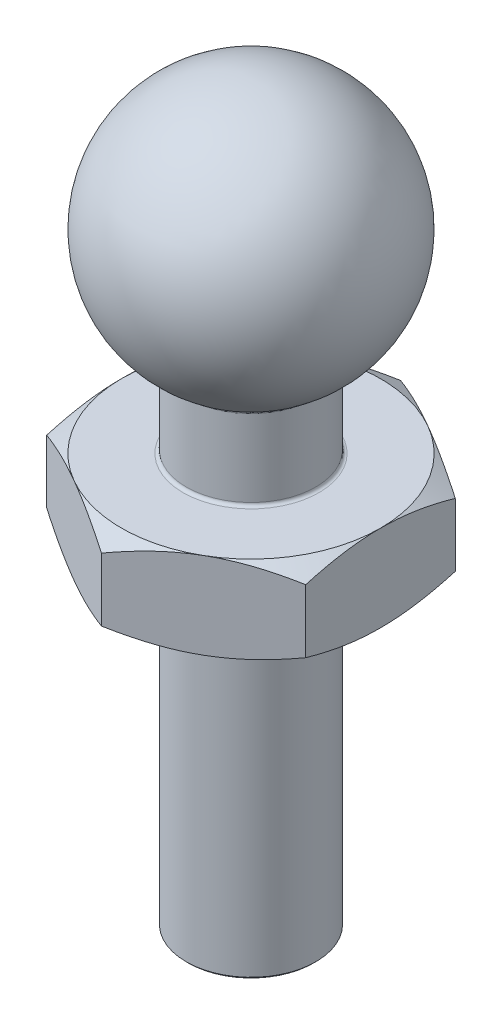
from build123d import *

# Parameters (mm, degrees)
CHAMFER1_SIZE       = 0.05
BOSS_EXTRUDE1_START = 2
SKETCH3_R           = 1.5
BOSS_EXTRUDE1_DEPTH = 2
SKETCH4_OUTSIDE_W   = 18.79
SKETCH4_OUTSIDE_H   = 19.718
SKETCH4_OUTSIDE_R   = 3
CUT_EXTRUDE1_DEPTH  = 2
CUT_EXTRUDE1_DRAFT  = -60
SKETCH5_OUTSIDE_W   = 18.79
SKETCH5_OUTSIDE_H   = 19.718
SKETCH5_OUTSIDE_R   = 3
CUT_EXTRUDE2_DEPTH  = 2
CUT_EXTRUDE2_DRAFT  = -60
FILLET1_R           = 0.075


with BuildPart() as part:
    # Sketch1 → Revolve1 (revolve)
    with BuildSketch(Plane.XY):
        with BuildLine():
            Line((0, 0), (1.5, 0))
            Line((1.5, 0), (1.5, 11.401923789))
            ThreePointArc((1.5, 11.401923789), (2.897777479, 14.776457135), (0, 17))
            Line((0, 17), (0, 11))
            Line((0, 11), (0, 0))
        make_face()
    revolve(axis=Axis((0, 11, 0), (0, -1, 0)))

    # Chamfer1
    chamfer1_edges = [part.edges().sort_by_distance(p)[0] for p in [
        (-1.5, 0, 0),
    ]]
    chamfer(chamfer1_edges, length=CHAMFER1_SIZE)

    # Sketch3 → Boss-Extrude1 (add)
    with BuildSketch(Plane(origin=(0, 7.5, 0), x_dir=(1, 0, 0), z_dir=(0, 1, 0)).offset(BOSS_EXTRUDE1_START)):
        Polygon((0, -3.464101615), (3, -1.732050808), (3, 1.732050808), (0, 3.464101615), (-3, 1.732050808), (-3, -1.732050808), align=None)
        with Locations(Location((0, 0, 0), (0, 0, 270))):
            Circle(SKETCH3_R, mode=Mode.SUBTRACT)
    extrude(amount=-BOSS_EXTRUDE1_DEPTH)


with BuildPart() as cut_extrude1_tool:
    # Sketch4 outside → Cut-Extrude1 (with draft: the straight prism first)
    with BuildSketch(Plane.XZ.offset(-7.5)):
        Rectangle(SKETCH4_OUTSIDE_W, SKETCH4_OUTSIDE_H)
        Circle(SKETCH4_OUTSIDE_R, mode=Mode.SUBTRACT)
    extrude(amount=-CUT_EXTRUDE1_DEPTH)
    # Cut-Extrude1: the draft: its side faces are tilted about the plane it starts from
    cut_extrude1_sides = [cut_extrude1_tool.faces().sort_by_distance(p)[0] for p in [
        (0, 8.5, -9.859),
        (9.395, 8.5, 0),
        (0, 8.5, 9.859),
        (-9.395, 8.5, 0),
        (-3, 8.5, 0),
    ]]
    draft(cut_extrude1_sides, Plane.XZ.offset(-7.5), CUT_EXTRUDE1_DRAFT)


with BuildPart() as part_1:
    add(part.part)

    # Cut-Extrude1: cut by cut_extrude1_tool
    add(cut_extrude1_tool.part, mode=Mode.SUBTRACT)


with BuildPart() as cut_extrude2_tool:
    # Sketch5 outside → Cut-Extrude2 (with draft: the straight prism first)
    with BuildSketch(Plane(origin=(0, 9.5, 0), x_dir=(1, 0, 0), z_dir=(0, 1, 0))):
        Rectangle(SKETCH5_OUTSIDE_W, SKETCH5_OUTSIDE_H)
        Circle(SKETCH5_OUTSIDE_R, mode=Mode.SUBTRACT)
    extrude(amount=-CUT_EXTRUDE2_DEPTH)
    # Cut-Extrude2: the draft: its side faces are tilted about the plane it starts from
    cut_extrude2_sides = [cut_extrude2_tool.faces().sort_by_distance(p)[0] for p in [
        (0, 8.5, 9.859),
        (9.395, 8.5, 0),
        (0, 8.5, -9.859),
        (-9.395, 8.5, 0),
        (-3, 8.5, 0),
    ]]
    draft(cut_extrude2_sides, Plane(origin=(0, 9.5, 0), x_dir=(1, 0, 0), z_dir=(0, 1, 0)), CUT_EXTRUDE2_DRAFT)


with BuildPart() as part_2:
    add(part_1.part)

    # Cut-Extrude2: cut by cut_extrude2_tool
    add(cut_extrude2_tool.part, mode=Mode.SUBTRACT)

    # Fillet1
    fillet1_edges = [part_2.edges().sort_by_distance(p)[0] for p in [
        (-1.5, 9.5, 0),
        (-1.5, 11.401923789, 0),
    ]]
    fillet(fillet1_edges, radius=FILLET1_R)


solid = part_2.part
